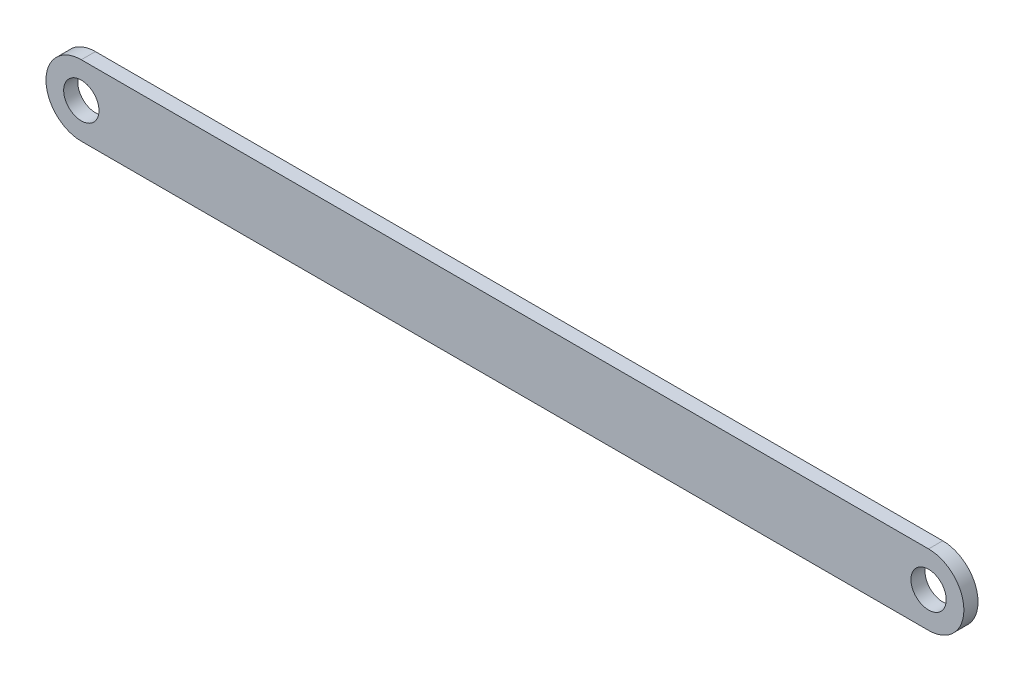
from build123d import *

# Parameters (mm, degrees)
SKETCH1_R           = 2.5
BOSS_EXTRUDE1_DEPTH = 2


with BuildPart() as part:
    # Sketch1 → Boss-Extrude1 (new body)
    with BuildSketch(Plane.XY):
        with BuildLine():
            Line((-34.491525424, 5), (85.508474576, 5))
            ThreePointArc((85.508474576, 5), (90.508474576, 0), (85.508474576, -5))
            Line((85.508474576, -5), (-34.491525424, -5))
            ThreePointArc((-34.491525424, -5), (-39.491525424, 0), (-34.491525424, 5))
        make_face()
        with Locations((-34.491525424, 0)):
            Circle(SKETCH1_R, mode=Mode.SUBTRACT)
        with Locations((85.508474576, 0)):
            Circle(SKETCH1_R, mode=Mode.SUBTRACT)
    extrude(amount=BOSS_EXTRUDE1_DEPTH)


solid = part.part
